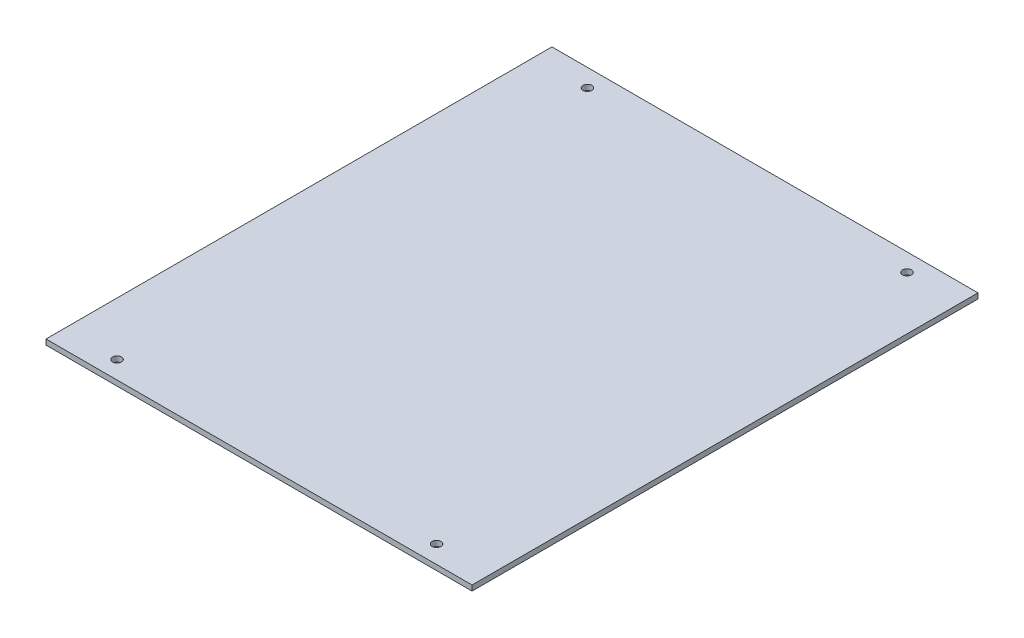
from build123d import *

# Parameters (mm, degrees)
SKETCH1_W           = 240
SKETCH1_H           = 285
BOSS_EXTRUDE1_DEPTH = 3
CUT_EXTRUDE1_REACH  = 188.32
SKETCH2_R           = 2.5


with BuildPart() as part:
    # Sketch1 → Boss-Extrude1 (new body)
    with BuildSketch(Plane(origin=(0, 0, 0), x_dir=(1, 0, 0), z_dir=(0, 1, 0))):
        Rectangle(SKETCH1_W, SKETCH1_H)
    extrude(amount=BOSS_EXTRUDE1_DEPTH)

    # Sketch2 → Cut-Extrude1 (cut, up to next)
    with BuildSketch(Plane.XZ, mode=Mode.PRIVATE) as cut_extrude1_sk1:
        with Locations(Location((-90, 132.5, 0), (0, 0, 270))):
            Circle(SKETCH2_R)
    cut_extrude1_tool1 = extrude(cut_extrude1_sk1.sketch, amount=-CUT_EXTRUDE1_REACH, mode=Mode.PRIVATE) & part.part
    # Sketch2 → Cut-Extrude1 (cut, up to next)
    with BuildSketch(Plane.XZ, mode=Mode.PRIVATE) as cut_extrude1_sk2:
        with Locations(Location((-90, -132.5, 0), (0, 0, 270))):
            Circle(SKETCH2_R)
    cut_extrude1_tool2 = extrude(cut_extrude1_sk2.sketch, amount=-CUT_EXTRUDE1_REACH, mode=Mode.PRIVATE) & part.part
    # Sketch2 → Cut-Extrude1 (cut, up to next)
    with BuildSketch(Plane.XZ, mode=Mode.PRIVATE) as cut_extrude1_sk3:
        with Locations(Location((90, 132.5, 0), (0, 0, 270))):
            Circle(SKETCH2_R)
    cut_extrude1_tool3 = extrude(cut_extrude1_sk3.sketch, amount=-CUT_EXTRUDE1_REACH, mode=Mode.PRIVATE) & part.part
    # Sketch2 → Cut-Extrude1 (cut, up to next)
    with BuildSketch(Plane.XZ, mode=Mode.PRIVATE) as cut_extrude1_sk4:
        with Locations(Location((90, -132.5, 0), (0, 0, 270))):
            Circle(SKETCH2_R)
    cut_extrude1_tool4 = extrude(cut_extrude1_sk4.sketch, amount=-CUT_EXTRUDE1_REACH, mode=Mode.PRIVATE) & part.part
    add(cut_extrude1_tool1.solids().sort_by_distance((-90, 0, 132.5))[0], mode=Mode.SUBTRACT)
    add(cut_extrude1_tool2.solids().sort_by_distance((-90, 0, -132.5))[0], mode=Mode.SUBTRACT)
    add(cut_extrude1_tool3.solids().sort_by_distance((90, 0, 132.5))[0], mode=Mode.SUBTRACT)
    add(cut_extrude1_tool4.solids().sort_by_distance((90, 0, -132.5))[0], mode=Mode.SUBTRACT)


solid = part.part
